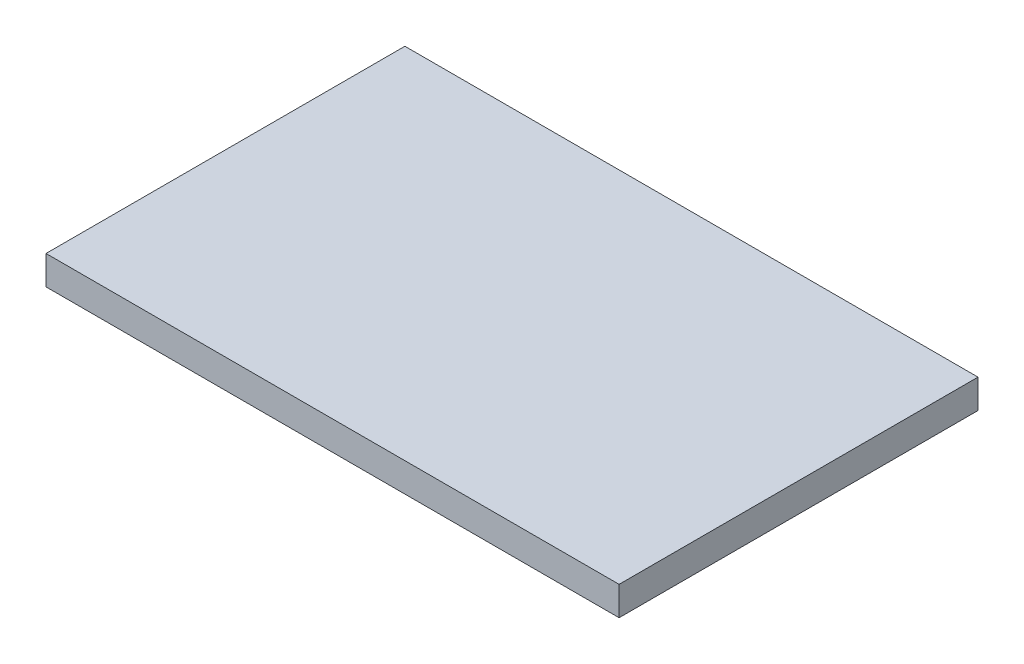
from build123d import *

# Parameters (mm, degrees)
SKETCH_2_W      = 495
SKETCH_2_H      = 310
EXTRUDE_2_DEPTH = 25


with BuildPart() as part:
    # Эскиз2 → Бобышка-Вытянуть2 (new body)
    with BuildSketch(Plane(origin=(0, 0, 0), x_dir=(1, 0, 0), z_dir=(0, 1, 0))):
        with Locations((181.295736557, 122.936366529)):
            Rectangle(SKETCH_2_W, SKETCH_2_H)
    extrude(amount=EXTRUDE_2_DEPTH)


solid = part.part
